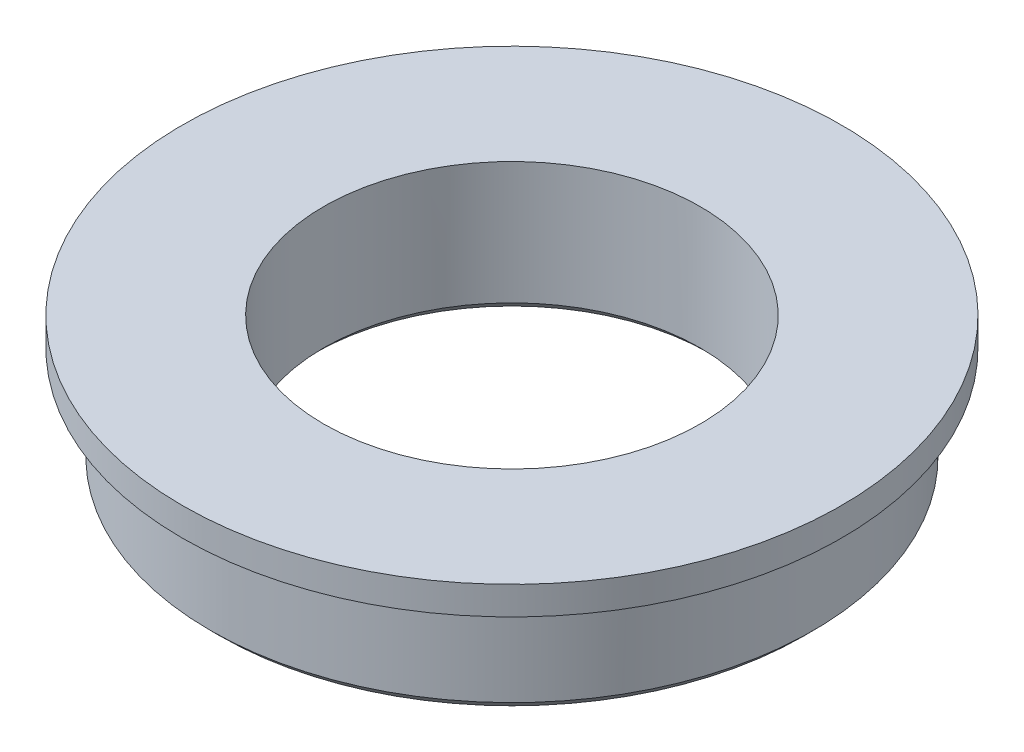
from build123d import *

# Parameters (mm, degrees)
CHAMFER_1_SIZE = 0.5


with BuildPart() as part:
    # 草图1 → 旋转1 (revolve)
    with BuildSketch(Plane.XY, mode=Mode.PRIVATE) as revolve_1_sk:
        Polygon((-10, 0), (-10, 7), (-17.5, 7), (-17.5, 5.5), (-16, 5.5), (-16, 0), align=None)
    revolve(revolve_1_sk.sketch.rotate(Axis((0, 90.707162858, 0), (0, -1, 0)), 270), axis=Axis((0, 90.707162858, 0), (0, -1, 0)))

    # 倒角1
    chamfer_1_edges = [part.edges().sort_by_distance(p)[0] for p in [
        (0, 0, -16),
        (0, 0, -10),
    ]]
    chamfer(chamfer_1_edges, length=CHAMFER_1_SIZE)


solid = part.part
